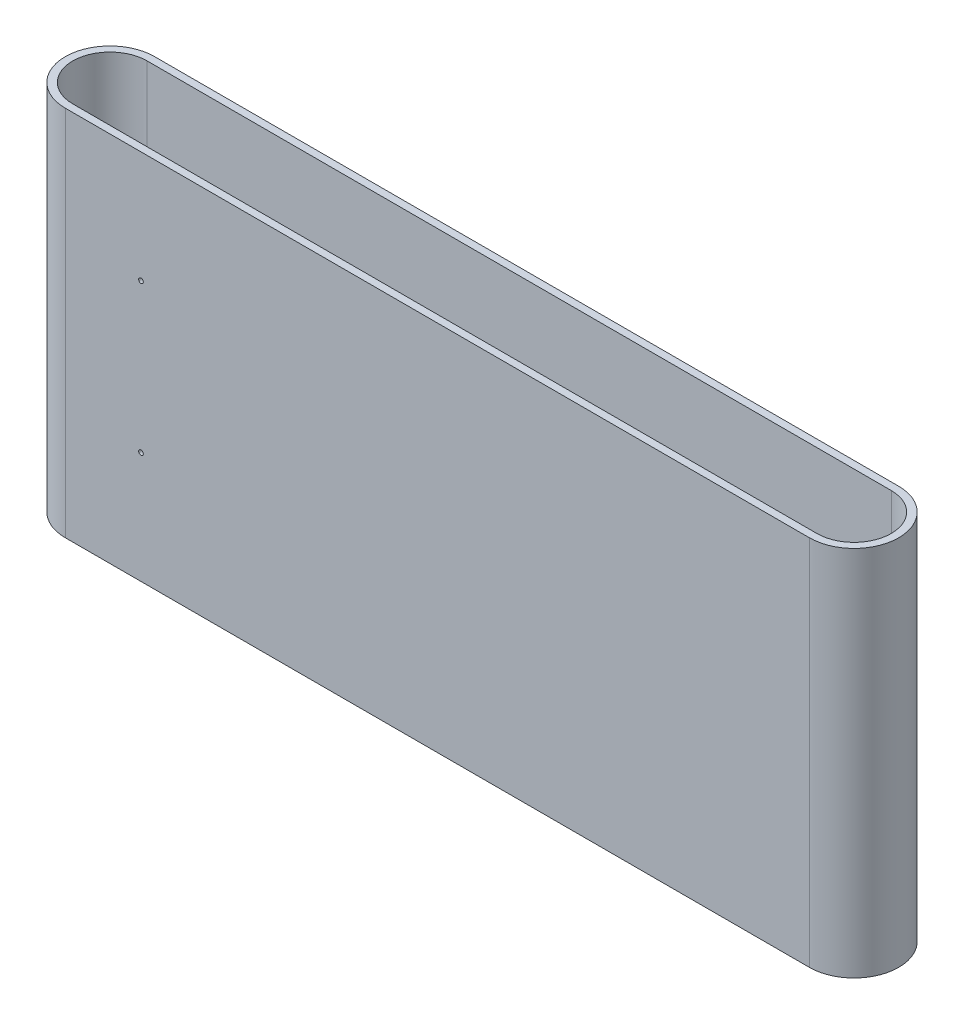
from build123d import *

# Parameters (mm, degrees)
EXTRUDE_1_DEPTH    = 200
HOLE_WIZARD_M3_1_D = 2.5


with BuildPart() as part:
    # 草图1 → 拉伸-薄壁1 (new body)
    with BuildSketch(Plane(origin=(0, 0, 0), x_dir=(1, 0, 0), z_dir=(0, 1, 0))):
        with BuildLine():
            Line((400, -24), (0, -24))
            ThreePointArc((0, -24), (-24, 0), (0, 24))
            Line((0, 24), (400, 24))
            ThreePointArc((400, 24), (424, 0), (400, -24))
        make_face()
        with BuildLine():
            Line((400, -20), (0, -20))
            ThreePointArc((0, -20), (-20, 0), (0, 20))
            Line((0, 20), (400, 20))
            ThreePointArc((400, 20), (420, 0), (400, -20))
        make_face(mode=Mode.SUBTRACT)
    extrude(amount=EXTRUDE_1_DEPTH)

    # M3 螺纹孔1 (through all)
    with Locations(Plane.XY.offset(24)):
        with Locations((40.682677542, 140), (40.682677542, 60)):
            Hole(HOLE_WIZARD_M3_1_D / 2)


solid = part.part
